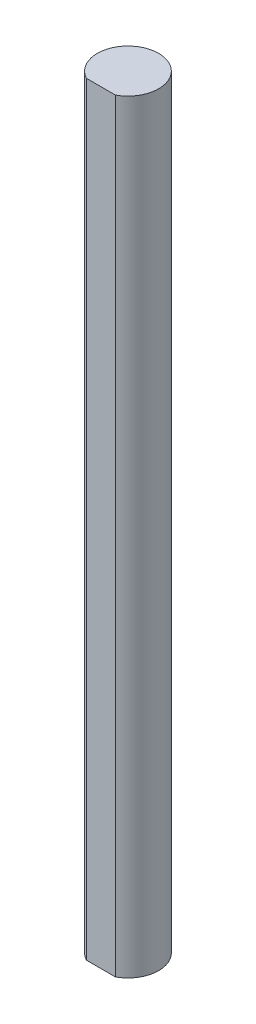
from build123d import *

# Parameters (mm, degrees)
BOSS_EXTRUDE1_DEPTH = 79


with BuildPart() as part:
    # Sketch1 → Boss-Extrude1 (new body)
    with BuildSketch(Plane(origin=(0, 0, 0), x_dir=(1, 0, 0), z_dir=(0, 1, 0))):
        with BuildLine():
            Line((-1.5, -2.798325392), (1.5, -2.798325392))
            ThreePointArc((1.5, -2.798325392), (0, 3.175), (-1.5, -2.798325392))
        make_face()
    extrude(amount=-BOSS_EXTRUDE1_DEPTH)


solid = part.part
